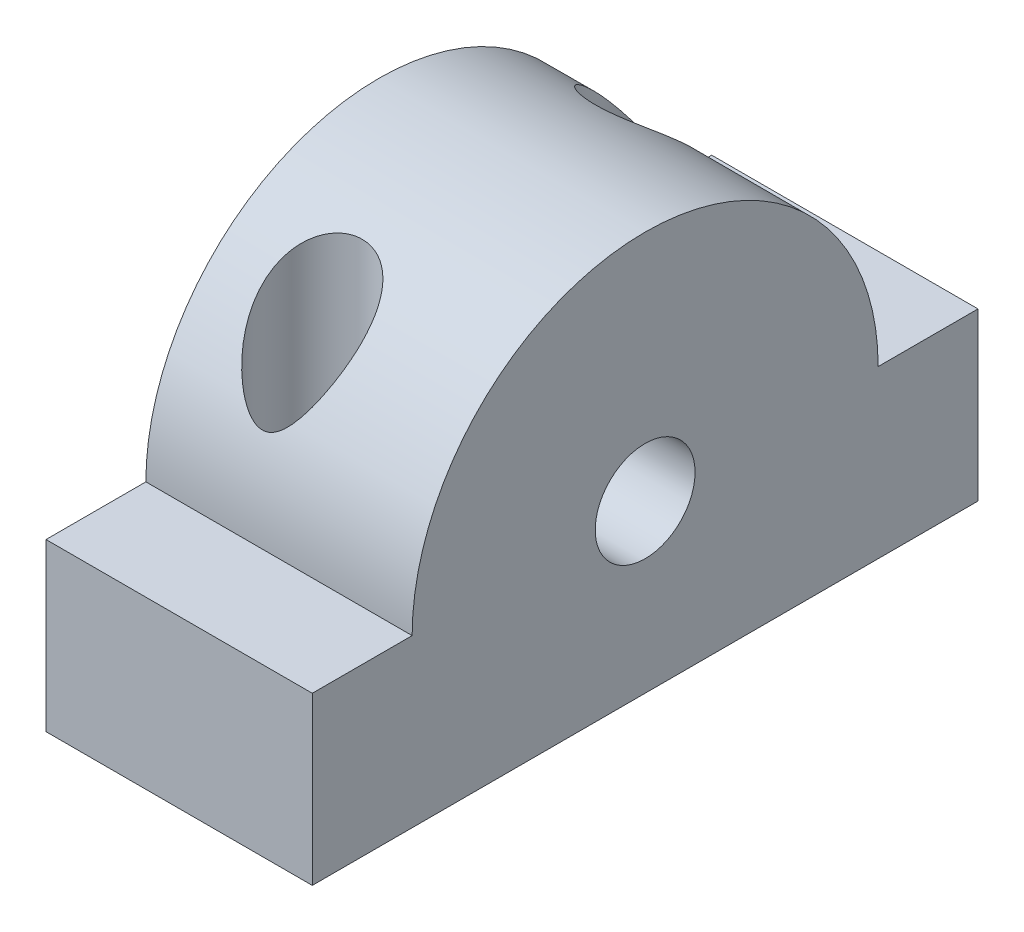
from build123d import *

# Parameters (mm, degrees)
BOSS_EXTRUDE1_DEPTH = 8
SKETCH3_R           = 1.5
CUT_EXTRUDE1_DEPTH  = 15
SKETCH4_R           = 1.5
CUT_EXTRUDE2_DEPTH  = 10


with BuildPart() as part:
    # Sketch1 → Boss-Extrude1 (new body)
    with BuildSketch(Plane(origin=(0, 0, 0), x_dir=(0, 0, -1), z_dir=(1, 0, 0))):
        with BuildLine():
            Line((17, 0), (20, 0))
            Line((20, 0), (20, -5))
            Line((20, -5), (0, -5))
            Line((0, -5), (0, 0))
            Line((0, 0), (3, 0))
            ThreePointArc((3, 0), (10, 7), (17, 0))
        make_face()
    extrude(amount=BOSS_EXTRUDE1_DEPTH)

    # Sketch3 → Cut-Extrude1 (cut)
    with BuildSketch(Plane.XZ.offset(5)):
        with Locations(Location((3, -5, 0), (0, 0, 270))):
            Circle(SKETCH3_R)
        with Locations(Location((3, -15, 0), (0, 0, 270))):
            Circle(SKETCH3_R)
    extrude(amount=-CUT_EXTRUDE1_DEPTH, mode=Mode.SUBTRACT)

    # Sketch4 → Cut-Extrude2 (cut)
    with BuildSketch(Plane(origin=(8, 0, 0), x_dir=(0, 0, -1), z_dir=(1, 0, 0))):
        with Locations((10, 0)):
            Circle(SKETCH4_R)
    extrude(amount=-CUT_EXTRUDE2_DEPTH, mode=Mode.SUBTRACT)


solid = part.part
